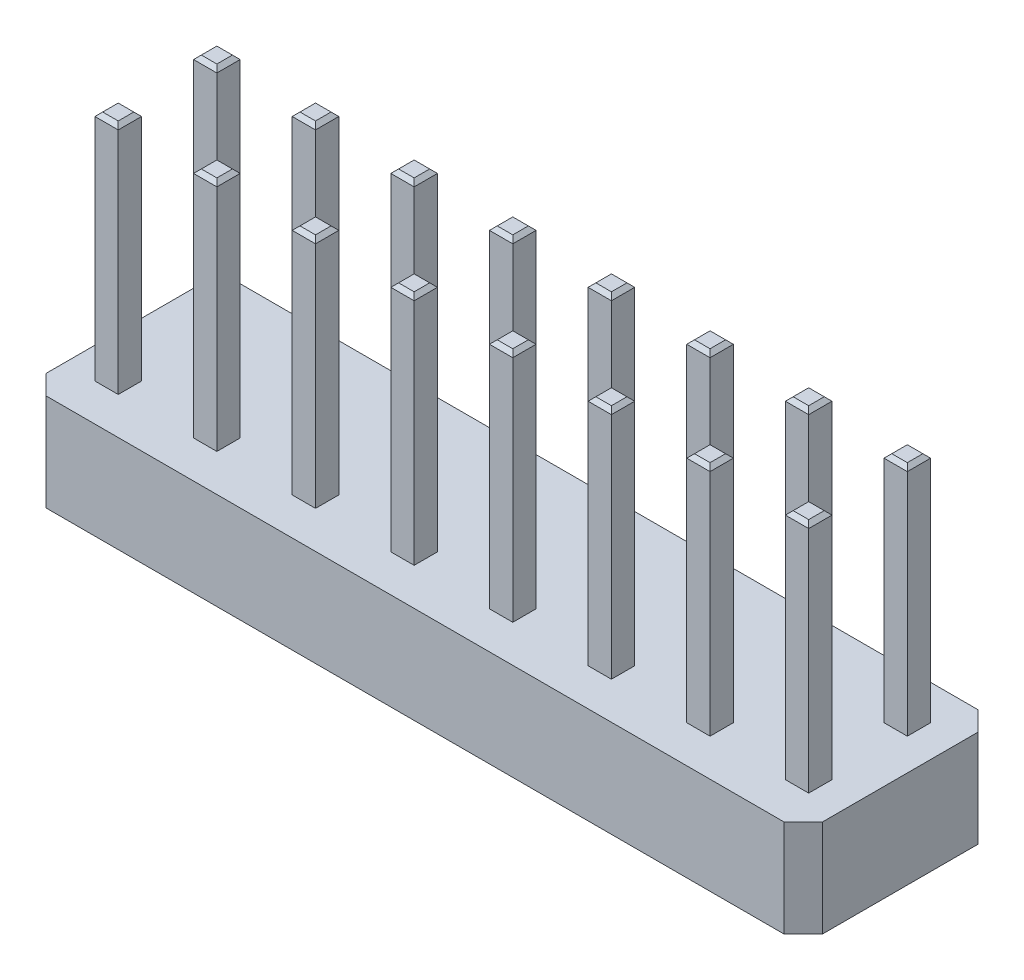
from build123d import *

# Parameters (mm, degrees)
ESQUISSE1_W        = 20
ESQUISSE1_H        = 5
BOSS_EXTRU_1_DEPTH = 2.5
ESQUISSE2_W        = 0.6
ESQUISSE2_H        = 0.6
BOSS_EXTRU_2_DEPTH = 6
CHANFREIN1_SIZE    = 0.1
CHANFREIN2_SIZE    = 0.5


with BuildPart() as part:
    # Esquisse1 → Boss.-Extru.1 (new body)
    with BuildSketch(Plane(origin=(0, 0, 0), x_dir=(1, 0, 0), z_dir=(0, 1, 0))):
        with Locations((10, -2.5)):
            Rectangle(ESQUISSE1_W, ESQUISSE1_H)
    extrude(amount=BOSS_EXTRU_1_DEPTH)

    # Esquisse2 → Boss.-Extru.2 (add)
    with BuildSketch(Plane(origin=(0, 2.5, 0), x_dir=(1, 0, 0), z_dir=(0, 1, 0))):
        with Locations((1.1, -1.2)):
            Rectangle(ESQUISSE2_W, ESQUISSE2_H)
        with Locations((1.1, -3.74)):
            Rectangle(ESQUISSE2_W, ESQUISSE2_H)
        with Locations((3.64, -1.2)):
            Rectangle(ESQUISSE2_W, ESQUISSE2_H)
        with Locations((3.64, -3.74)):
            Rectangle(ESQUISSE2_W, ESQUISSE2_H)
        with Locations((6.18, -1.2)):
            Rectangle(ESQUISSE2_W, ESQUISSE2_H)
        with Locations((6.18, -3.74)):
            Rectangle(ESQUISSE2_W, ESQUISSE2_H)
        with Locations((8.72, -1.2)):
            Rectangle(ESQUISSE2_W, ESQUISSE2_H)
        with Locations((8.72, -3.74)):
            Rectangle(ESQUISSE2_W, ESQUISSE2_H)
        with Locations((11.26, -1.2)):
            Rectangle(ESQUISSE2_W, ESQUISSE2_H)
        with Locations((11.26, -3.74)):
            Rectangle(ESQUISSE2_W, ESQUISSE2_H)
        with Locations((13.8, -1.2)):
            Rectangle(ESQUISSE2_W, ESQUISSE2_H)
        with Locations((13.8, -3.74)):
            Rectangle(ESQUISSE2_W, ESQUISSE2_H)
        with Locations((16.34, -1.2)):
            Rectangle(ESQUISSE2_W, ESQUISSE2_H)
        with Locations((16.34, -3.74)):
            Rectangle(ESQUISSE2_W, ESQUISSE2_H)
        with Locations((18.88, -1.2)):
            Rectangle(ESQUISSE2_W, ESQUISSE2_H)
        with Locations((18.88, -3.74)):
            Rectangle(ESQUISSE2_W, ESQUISSE2_H)
    extrude(amount=BOSS_EXTRU_2_DEPTH)

    # Chanfrein1
    chanfrein1_edges = [part.edges().sort_by_distance(p)[0] for p in [
        (10.96, 8.5, 1.2),
        (11.26, 8.5, 1.5),
        (11.56, 8.5, 1.2),
        (11.26, 8.5, 0.9),
        (10.96, 8.5, 3.74),
        (11.26, 8.5, 4.04),
        (11.56, 8.5, 3.74),
        (11.26, 8.5, 3.44),
        (13.5, 8.5, 1.2),
        (13.8, 8.5, 1.5),
        (14.1, 8.5, 1.2),
        (13.8, 8.5, 0.9),
        (13.5, 8.5, 3.74),
        (13.8, 8.5, 4.04),
        (14.1, 8.5, 3.74),
        (13.8, 8.5, 3.44),
        (16.04, 8.5, 1.2),
        (16.34, 8.5, 1.5),
        (16.64, 8.5, 1.2),
        (16.34, 8.5, 0.9),
        (16.04, 8.5, 3.74),
        (16.34, 8.5, 4.04),
        (16.64, 8.5, 3.74),
        (16.34, 8.5, 3.44),
        (18.58, 8.5, 1.2),
        (18.88, 8.5, 1.5),
        (19.18, 8.5, 1.2),
        (0.8, 8.5, 1.2),
        (18.88, 8.5, 0.9),
        (1.1, 8.5, 1.5),
        (1.4, 8.5, 1.2),
        (1.1, 8.5, 0.9),
        (18.58, 8.5, 3.74),
        (18.88, 8.5, 4.04),
        (19.18, 8.5, 3.74),
        (18.88, 8.5, 3.44),
        (0.8, 8.5, 3.74),
        (1.1, 8.5, 4.04),
        (1.4, 8.5, 3.74),
        (1.1, 8.5, 3.44),
        (3.34, 8.5, 1.2),
        (3.64, 8.5, 1.5),
        (3.94, 8.5, 1.2),
        (3.64, 8.5, 0.9),
        (3.34, 8.5, 3.74),
        (3.64, 8.5, 4.04),
        (3.94, 8.5, 3.74),
        (3.64, 8.5, 3.44),
        (5.88, 8.5, 1.2),
        (6.18, 8.5, 1.5),
        (6.48, 8.5, 1.2),
        (6.18, 8.5, 0.9),
        (5.88, 8.5, 3.74),
        (6.18, 8.5, 4.04),
        (6.48, 8.5, 3.74),
        (6.18, 8.5, 3.44),
        (8.42, 8.5, 1.2),
        (8.72, 8.5, 1.5),
        (9.02, 8.5, 1.2),
        (8.72, 8.5, 0.9),
        (8.42, 8.5, 3.74),
        (8.72, 8.5, 4.04),
        (9.02, 8.5, 3.74),
        (8.72, 8.5, 3.44),
    ]]
    chamfer(chanfrein1_edges, length=CHANFREIN1_SIZE)

    # Chanfrein2
    chanfrein2_edges = [part.edges().sort_by_distance(p)[0] for p in [
        (0, 1.25, 0),
        (20, 1.25, 0),
        (20, 1.25, 5),
        (0, 1.25, 5),
    ]]
    chamfer(chanfrein2_edges, length=CHANFREIN2_SIZE)


solid = part.part
